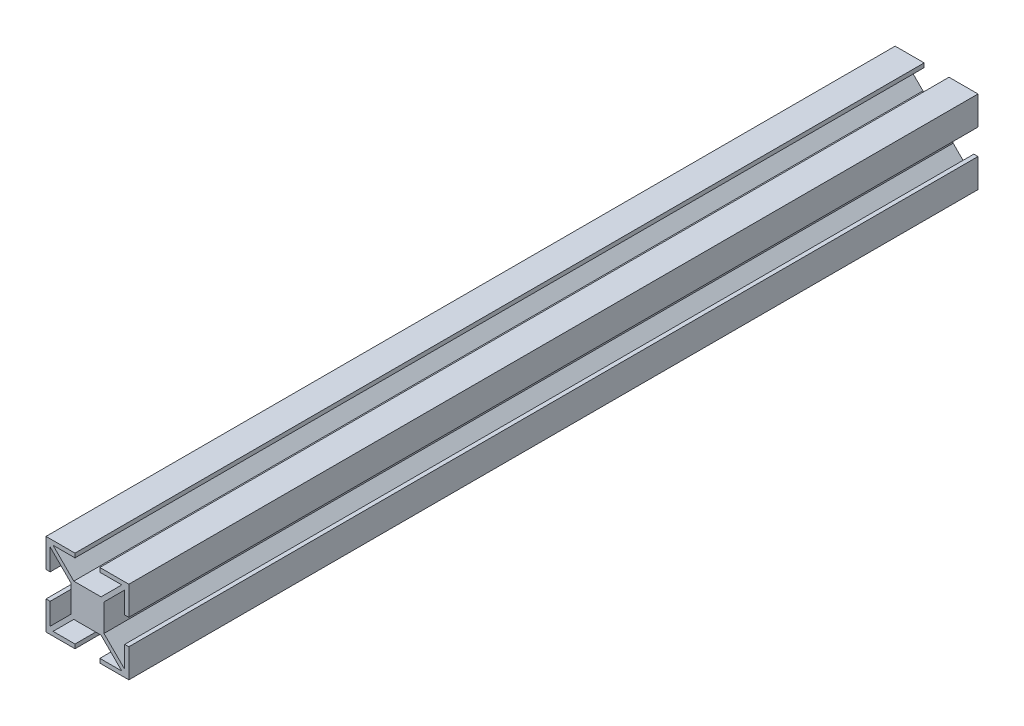
from build123d import *

# Parameters (mm, degrees)
BOSS_EXTRUDE1_DEPTH = 205


with BuildPart() as part:
    # Sketch2 → Boss-Extrude1 (new body)
    with BuildSketch(Plane.XY):
        Polygon((-10, 10), (-3, 10), (-3, 9), (-8.292893219, 9), (-3.292893219, 4), (3.292893219, 4), (8.292893219, 9), (3, 9), (3, 10), (10, 10), (10, 3.074044586), (9, 3.074044586), (9, 8.292893219), (4, 3.292893219), (4, -3.292893219), (9, -8.292893219), (9, -3.074044586), (10, -3.074044586), (10, -10), (3, -10), (3, -9), (8.292893219, -9), (3.292893219, -4), (-3.292893219, -4), (-8.292893219, -9), (-3, -9), (-3, -10), (-10, -10), (-10, -3.074044586), (-9, -3.074044586), (-9, -8.292893219), (-4, -3.292893219), (-4, 3.292893219), (-9, 8.292893219), (-9, 3.074044586), (-10, 3.074044586), align=None)
    extrude(amount=BOSS_EXTRUDE1_DEPTH)


solid = part.part
